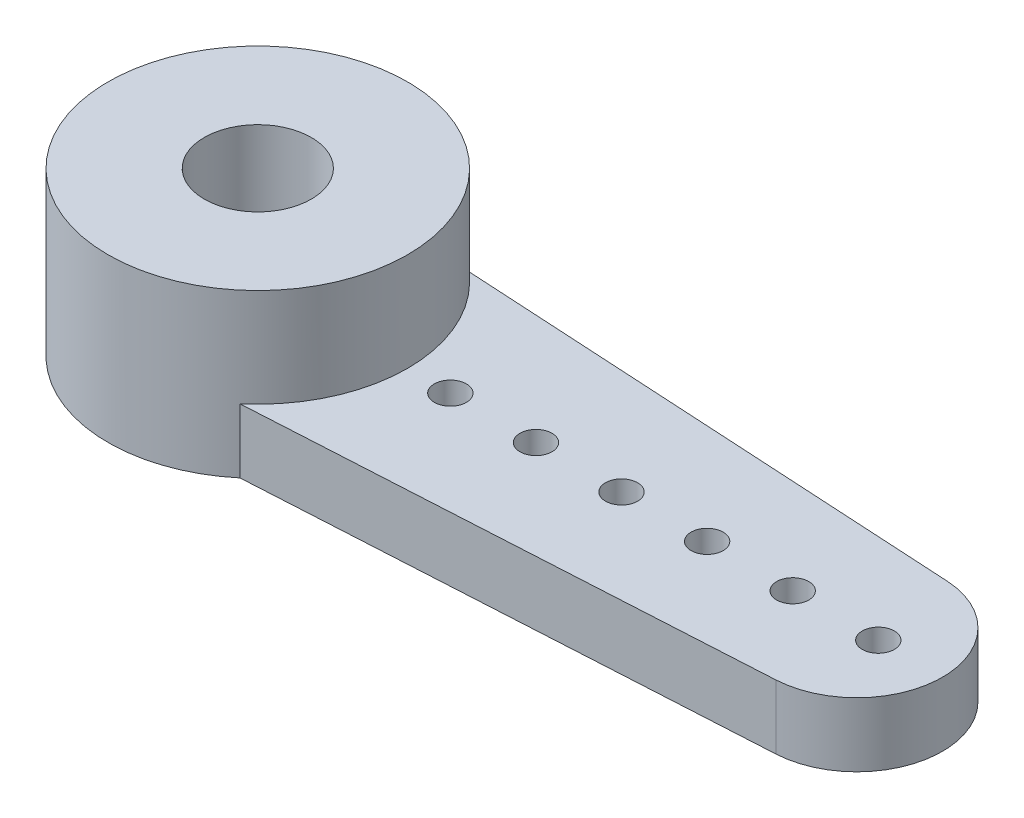
from build123d import *
from build123d.topology import SkipClean

# Parameters (mm, degrees)
BOSS_EXTRUDE1_DEPTH     = 1.5
SKETCH2_R               = 3.5
BOSS_EXTRUDE2_DEPTH     = 2.3
CUT_EXTRUDE1_DEPTH      = 17.539044712
CUT_EXTRUDE1_DEPTH_BACK = 17.539044712
SKETCH3_R               = 0.375
SKETCH3_R_2             = 1.25


with BuildPart() as part:
    # Sketch1 → Boss-Extrude1 (new body)
    with BuildSketch(Plane(origin=(0, 0, 0), x_dir=(1, 0, 0), z_dir=(0, 1, 0))):
        with BuildLine():
            Line((2.257072219, 2.675), (14.110649579, 2))
            ThreePointArc((14.110649579, 2), (16, 0), (14.110649579, -2))
            Line((14.110649579, -2), (2.257072219, -2.675))
            ThreePointArc((2.257072219, -2.675), (-3.5, 0), (2.257072219, 2.675))
        make_face()
    extrude(amount=BOSS_EXTRUDE1_DEPTH)

    # Sketch2 → Boss-Extrude2 (add)
    with SkipClean():  # the faces are left unmerged after this step: merging them gives an invalid solid
        with BuildSketch(Plane(origin=(0, 1.5, 0), x_dir=(1, 0, 0), z_dir=(0, 1, 0))):
            with Locations(Location((0, 0, 0), (0, 0, 49.843487791))):
                Circle(SKETCH2_R)
        extrude(amount=BOSS_EXTRUDE2_DEPTH)

    # Sketch3 → Cut-Extrude1 (cut, two sides: drawn at the far end of the back side and taken through both)
    with SkipClean():  # the faces are left unmerged after this step: merging them gives an invalid solid
        with BuildSketch(Plane(origin=(0, 1.5, 0), x_dir=(1, 0, 0), z_dir=(0, 1, 0)).offset(-CUT_EXTRUDE1_DEPTH_BACK)):
            with Locations(Location((4.5, 0, 0), (0, 0, 270))):
                Circle(SKETCH3_R)
            with Locations(Location((0, 0, 0), (0, 0, 270))):
                Circle(SKETCH3_R_2)
            with Locations(Location((6.5, 0, 0), (0, 0, 270))):
                Circle(SKETCH3_R)
            with Locations(Location((8.5, 0, 0), (0, 0, 270))):
                Circle(SKETCH3_R)
            with Locations(Location((10.5, 0, 0), (0, 0, 270))):
                Circle(SKETCH3_R)
            with Locations(Location((12.5, 0, 0), (0, 0, 270))):
                Circle(SKETCH3_R)
            with Locations(Location((14.5, 0, 0), (0, 0, 270))):
                Circle(SKETCH3_R)
        extrude(amount=CUT_EXTRUDE1_DEPTH + CUT_EXTRUDE1_DEPTH_BACK, mode=Mode.SUBTRACT)


solid = part.part
